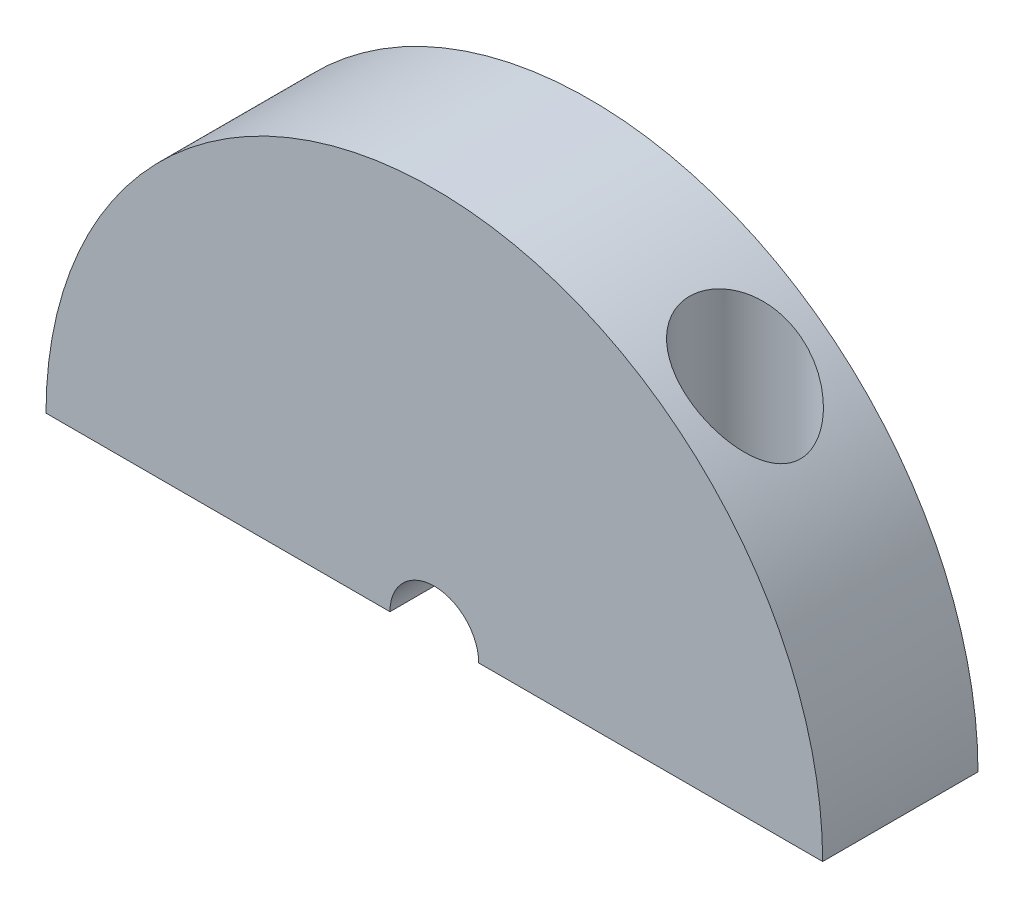
from build123d import *
from build123d.topology import SkipClean

# Parameters (mm, degrees)
BOSS_EXTRU_1_DEPTH      = 5
BOSS_EXTRU_3_START      = 2
BOSS_EXTRU_3_DEPTH      = 2
ESQUISSE5_R             = 0.5
ESQUISSE5_R_2           = 2.5
ENL_V_MAT_EXTRU_1_DEPTH = 2
ESQUISSE7_R             = 2.5
ENL_V_MAT_EXTRU_2_DEPTH = 24.906066176
ESQUISSE8_R             = 2
ENL_V_MAT_EXTRU_3_DEPTH = 26.719642463


with BuildPart() as part:
    # Esquisse1 → Boss.-Extru.1 (new body)
    with BuildSketch(Plane.XY):
        with BuildLine():
            Line((-1.732050808, 1), (1.732050808, 1))
            ThreePointArc((1.732050808, 1), (1.931851653, 0.51763809), (2, 0))
            Line((2, 0), (17.5, 0))
            ThreePointArc((17.5, 0), (0, 17.5), (-17.5, 0))
            Line((-17.5, 0), (-2, 0))
            ThreePointArc((-2, 0), (-1.931851653, 0.51763809), (-1.732050808, 1))
        make_face()
    extrude(amount=BOSS_EXTRU_1_DEPTH)

    # Esquisse3 → Boss.-Extru.3 (add)
    with SkipClean():  # the faces are left unmerged after this step: merging them gives an invalid solid
        with BuildSketch(Plane(origin=(0, 0, 0), x_dir=(-1, 0, 0), z_dir=(0, 0, -1)).offset(BOSS_EXTRU_3_START)):
            with BuildLine():
                Line((0, 2), (0, 17.5))
                ThreePointArc((0, 17.5), (-12.374368671, 12.374368671), (-17.5, 0))
                Line((-17.5, 0), (-2, 0))
                ThreePointArc((-2, 0), (-1.931851653, 0.51763809), (-1.732050808, 1))
                ThreePointArc((-1.732050808, 1), (-1, 1.732050808), (0, 2))
            make_face()
            with BuildLine():
                ThreePointArc((17.5, 0), (12.374368671, 12.374368671), (0, 17.5))
                Line((0, 17.5), (0, 2))
                ThreePointArc((0, 2), (1, 1.732050808), (1.732050808, 1))
                ThreePointArc((1.732050808, 1), (1.931851653, 0.51763809), (2, 0))
                Line((2, 0), (17.5, 0))
            make_face()
        extrude(amount=-BOSS_EXTRU_3_DEPTH)

    # Esquisse5 → Enlèv. mat.-Extru.1 (cut)
    with SkipClean():  # the faces are left unmerged after this step: merging them gives an invalid solid
        with BuildSketch(Plane.XZ):
            with Locations(Location((-10.5, 1.5, 0), (0, 0, 270))):
                Circle(ESQUISSE5_R)
            with Locations(Location((10.5, 1.5, 0), (0, 0, 270))):
                Circle(ESQUISSE5_R_2)
        extrude(amount=-ENL_V_MAT_EXTRU_1_DEPTH, mode=Mode.SUBTRACT)

    # Esquisse7 → Enlèv. mat.-Extru.2 (cut, through all)
    with SkipClean():  # the faces are left unmerged after this step: merging them gives an invalid solid
        with BuildSketch(Plane.XZ.offset(-2)):
            with Locations(Location((10.5, 1.5, 0), (0, 0, 270))):
                Circle(ESQUISSE7_R)
        extrude(amount=-ENL_V_MAT_EXTRU_2_DEPTH, mode=Mode.SUBTRACT)

    # Esquisse8 → Enlèv. mat.-Extru.3 (cut, through all)
    with SkipClean():  # the faces are left unmerged after this step: merging them gives an invalid solid
        with BuildSketch(Plane(origin=(0, 0, -2), x_dir=(-1, 0, 0), z_dir=(0, 0, -1))):
            Circle(ESQUISSE8_R)
        extrude(amount=-ENL_V_MAT_EXTRU_3_DEPTH, mode=Mode.SUBTRACT)


solid = part.part
